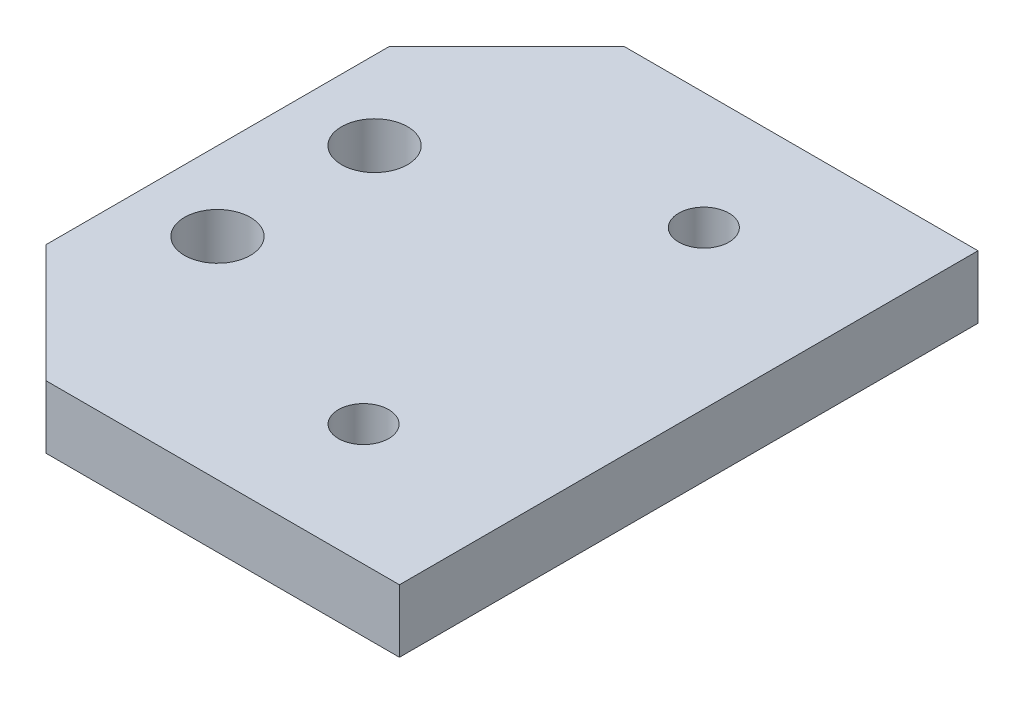
from build123d import *

# Parameters (mm, degrees)
SKETCH1_W           = 30
SKETCH1_H           = 36.83
SKETCH1_R           = 2.1
BOSS_EXTRUDE1_DEPTH = 4
CHAMFER1_SIZE       = 7.5
SKETCH2_R           = 1.6
CUT_EXTRUDE1_DEPTH  = 48.670209775


with BuildPart() as part:
    # Sketch1 → Boss-Extrude1 (new body)
    with BuildSketch(Plane(origin=(0, 0, 0), x_dir=(1, 0, 0), z_dir=(0, 1, 0))):
        with Locations((15, 18.415)):
            Rectangle(SKETCH1_W, SKETCH1_H)
        with Locations(Location((5, 23.415, 0), (0, 0, 270))):
            Circle(SKETCH1_R, mode=Mode.SUBTRACT)
        with Locations(Location((5, 13.415, 0), (0, 0, 270))):
            Circle(SKETCH1_R, mode=Mode.SUBTRACT)
    extrude(amount=BOSS_EXTRUDE1_DEPTH)

    # Chamfer1
    chamfer1_edges = [part.edges().sort_by_distance(p)[0] for p in [
        (0, 2, -36.83),
        (0, 2, 0),
    ]]
    chamfer(chamfer1_edges, length=CHAMFER1_SIZE)

    # Sketch2 → Cut-Extrude1 (cut, through all)
    with BuildSketch(Plane(origin=(0, 4, 0), x_dir=(1, 0, 0), z_dir=(0, 1, 0))):
        with Locations(Location((20, 29.377825135, 0), (0, 0, 270))):
            Circle(SKETCH2_R)
        with Locations(Location((20, 7.716339326, 0), (0, 0, 270))):
            Circle(SKETCH2_R)
    extrude(amount=-CUT_EXTRUDE1_DEPTH, mode=Mode.SUBTRACT)


solid = part.part
